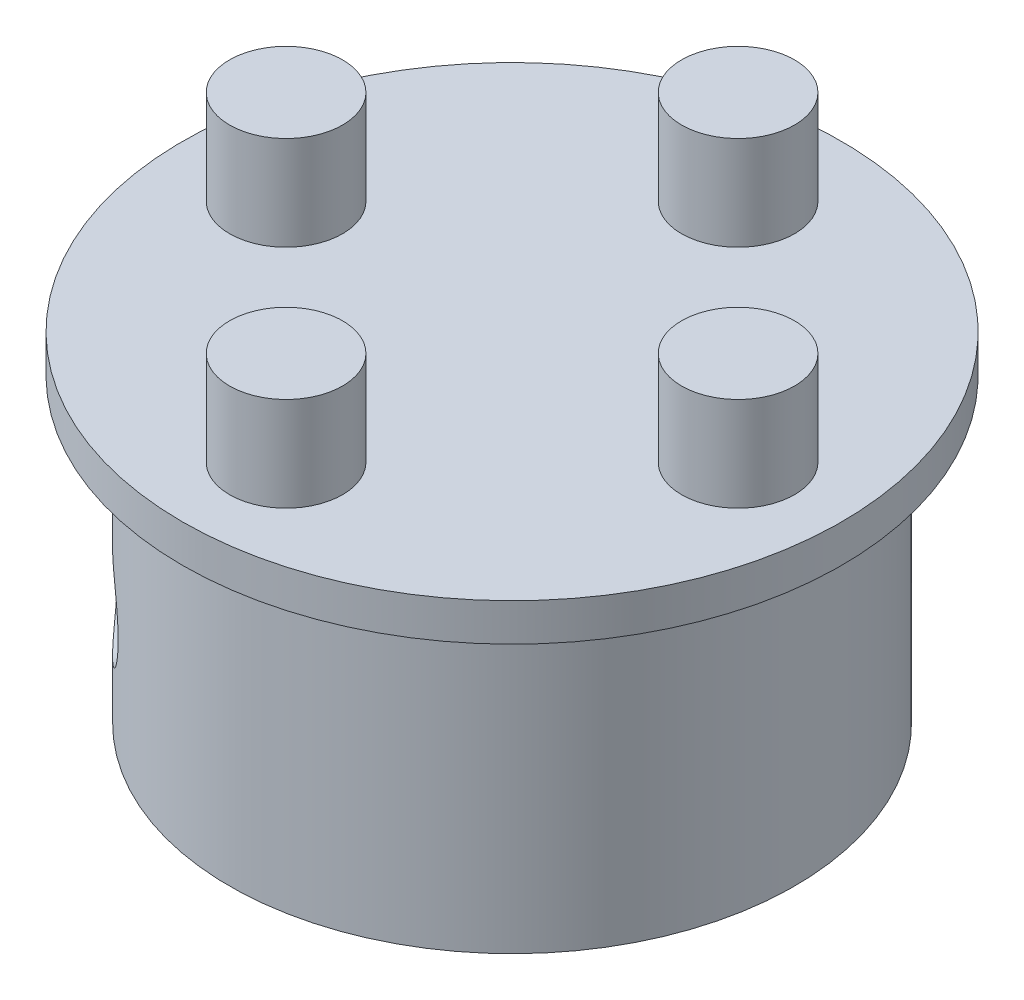
from build123d import *

# Parameters (mm, degrees)
SKETCH1_R           = 17.5
BOSS_EXTRUDE1_DEPTH = 2
SKETCH2_R           = 3
BOSS_EXTRUDE2_DEPTH = 5
SKETCH3_R           = 15
BOSS_EXTRUDE3_DEPTH = 16
SKETCH4_R           = 2
CUT_EXTRUDE1_DEPTH  = 5
SKETCH5_R           = 2.5
CUT_EXTRUDE2_DEPTH  = 10


with BuildPart() as part:
    # Sketch1 → Boss-Extrude1 (new body)
    with BuildSketch(Plane(origin=(0, 0, 0), x_dir=(1, 0, 0), z_dir=(0, 1, 0))):
        with Locations(Location((0, 0, 0), (0, 0, 270))):
            Circle(SKETCH1_R)
    extrude(amount=BOSS_EXTRUDE1_DEPTH)

    # Sketch2 → Boss-Extrude2 (add)
    with BuildSketch(Plane(origin=(0, 2, 0), x_dir=(1, 0, 0), z_dir=(0, 1, 0))):
        with Locations(Location((12, 0, 0), (0, 0, 270))):
            Circle(SKETCH2_R)
        with Locations(Location((0, -12, 0), (0, 0, 270))):
            Circle(SKETCH2_R)
        with Locations(Location((-12, 0, 0), (0, 0, 270))):
            Circle(SKETCH2_R)
        with Locations(Location((0, 12, 0), (0, 0, 270))):
            Circle(SKETCH2_R)
    extrude(amount=BOSS_EXTRUDE2_DEPTH)

    # Sketch3 → Boss-Extrude3 (add)
    with BuildSketch(Plane.XZ):
        with Locations(Location((0, 0, 0), (0, 0, 270))):
            Circle(SKETCH3_R)
    extrude(amount=BOSS_EXTRUDE3_DEPTH)

    # Sketch4 → Cut-Extrude1 (cut)
    with BuildSketch(Plane.XZ.offset(16)):
        with Locations(Location((-10, 0, 0), (0, 0, 270))):
            Circle(SKETCH4_R)
        with Locations(Location((0, 10, 0), (0, 0, 270))):
            Circle(SKETCH4_R)
        with Locations(Location((10, 0, 0), (0, 0, 270))):
            Circle(SKETCH4_R)
        with Locations(Location((0, -10, 0), (0, 0, 270))):
            Circle(SKETCH4_R)
    extrude(amount=-CUT_EXTRUDE1_DEPTH, mode=Mode.SUBTRACT)

    # Sketch5 → Cut-Extrude2 (cut)
    with BuildSketch(Plane(origin=(-8.121320344, 0, 8.121320344), x_dir=(0.7071067811865439, 0, 0.7071067811865512), z_dir=(-0.7071067811865512, 0, 0.7071067811865439))):
        with Locations(Location((0, -10.42298086, 0), (0, 0, 180))):
            Circle(SKETCH5_R)
    extrude(amount=CUT_EXTRUDE2_DEPTH, mode=Mode.SUBTRACT)


solid = part.part
